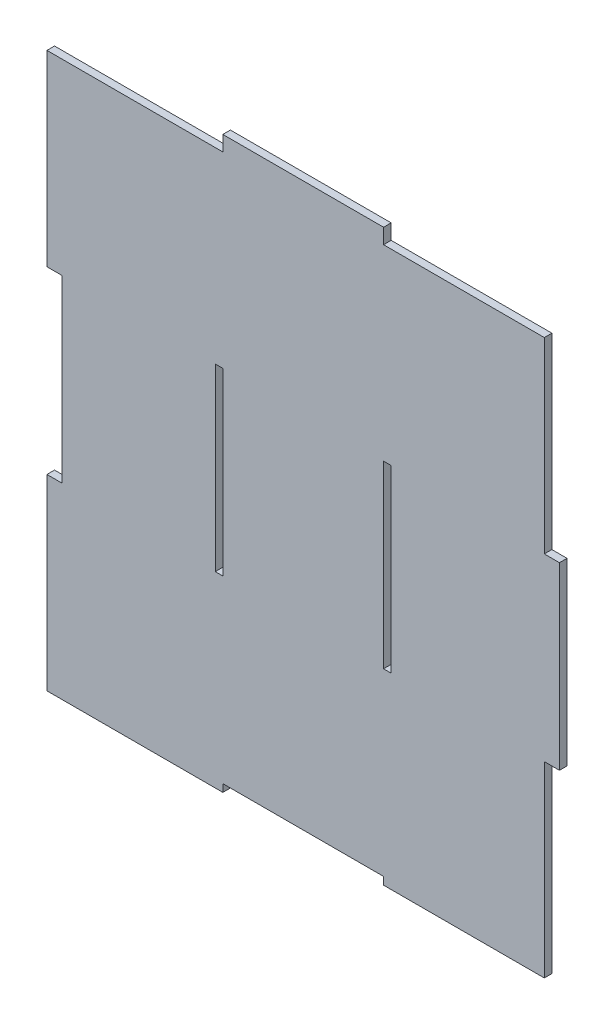
from build123d import *

# Parameters (mm, degrees)
SKETCH2_W           = 3.175
SKETCH2_H           = 75.333333334
BOSS_EXTRUDE1_DEPTH = 3.175
SKETCH3_W           = 3.175
SKETCH3_H           = 78.508333333
SKETCH3_W_2         = 67.333333334
SKETCH3_H_2         = 3.175
BOSS_EXTRUDE2_DEPTH = 3.175
SKETCH4_W           = 3.175
SKETCH4_H           = 78.508333333
CUT_EXTRUDE1_DEPTH  = 3.175


with BuildPart() as part:
    # Sketch2 → Boss-Extrude1 (new body)
    with BuildSketch(Plane.XY):
        Polygon((-113, 37.666666667), (-113, -37.666666667), (-116.175, -37.666666667), (-116.175, -116.175), (-45.666666667, -116.175), (-45.666666667, -113), (21.666666667, -113), (21.666666667, -116.175), (92.175, -116.175), (92.175, -37.666666667), (95.35, -37.666666667), (95.35, 37.666666667), (92.175, 37.666666667), (92.175, 116.175), (21.666666667, 116.175), (21.666666667, 119.35), (-45.666666667, 119.35), (-45.666666667, 116.175), (-116.175, 116.175), (-116.175, 37.666666667), align=None)
        with Locations((23.254166667, 0)):
            Rectangle(SKETCH2_W, SKETCH2_H, mode=Mode.SUBTRACT)
        with Locations((-47.254166667, 0)):
            Rectangle(SKETCH2_W, SKETCH2_H, mode=Mode.SUBTRACT)
    extrude(amount=BOSS_EXTRUDE1_DEPTH)

    # Sketch3 → Boss-Extrude2 (add)
    with BuildSketch(Plane.XY.offset(3.175)):
        with Locations((-117.7625, 76.920833334)):
            Rectangle(SKETCH3_W, SKETCH3_H)
        with Locations((-117.7625, -76.920833334)):
            Rectangle(SKETCH3_W, SKETCH3_H)
        with Locations((-12, 120.9375)):
            Rectangle(SKETCH3_W_2, SKETCH3_H_2)
    extrude(amount=-BOSS_EXTRUDE2_DEPTH)

    # Sketch4 → Cut-Extrude1 (cut)
    with BuildSketch(Plane.XY.offset(3.175)):
        with Locations((90.5875, 76.920833334)):
            Rectangle(SKETCH4_W, SKETCH4_H)
        with Locations((90.5875, -76.920833334)):
            Rectangle(SKETCH4_W, SKETCH4_H)
    extrude(amount=-CUT_EXTRUDE1_DEPTH, mode=Mode.SUBTRACT)


solid = part.part
